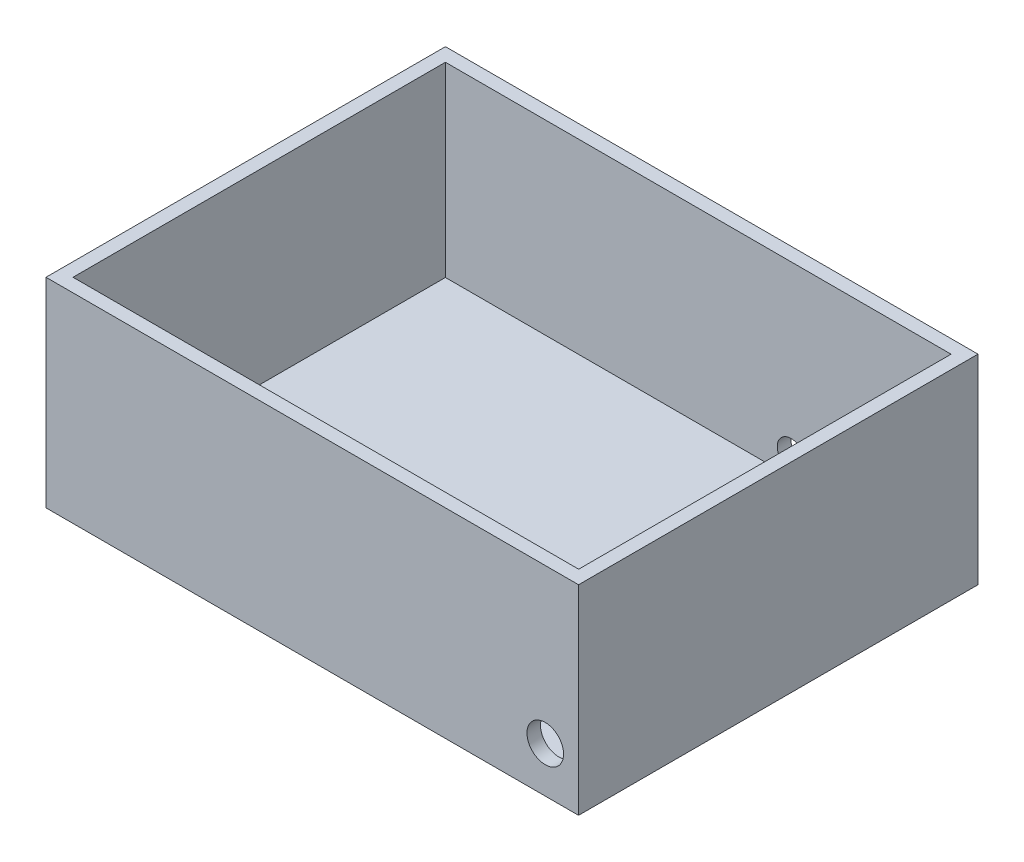
from build123d import *

# Parameters (mm, degrees)
SKETCH4_W                = 203.2
SKETCH4_H                = 152.4
BOSS_EXTRUDE3_DEPTH      = 76.2
SKETCH13_W               = 192.926700431
SKETCH13_H               = 142.08822526
CUT_EXTRUDE9_DEPTH       = 71.12
CUT_EXTRUDE15_DEPTH      = 6.604
CUT_EXTRUDE15_DEPTH_BACK = 12.7
SKETCH20_R               = 6.35
SKETCH18_R               = 5.334
CUT_EXTRUDE17_DEPTH      = 12.7
CUT_EXTRUDE20_DEPTH      = 12.446
CUT_EXTRUDE20_DEPTH_BACK = 10.922
SKETCH23_R               = 6.985
SKETCH24_W               = 0.314102564
SKETCH24_H               = 3.5
CUT_EXTRUDE21_DEPTH      = 3.81


with BuildPart() as part:
    # Sketch4 → Boss-Extrude3 (new body)
    with BuildSketch(Plane(origin=(0, 0, 0), x_dir=(1, 0, 0), z_dir=(0, 1, 0))):
        with Locations((-4.993667346, 11.568489701)):
            Rectangle(SKETCH4_W, SKETCH4_H)
    extrude(amount=BOSS_EXTRUDE3_DEPTH)

    # Sketch13 → Cut-Extrude9 (cut)
    with BuildSketch(Plane(origin=(0, 76.2, 0), x_dir=(1, 0, 0), z_dir=(0, 1, 0))):
        with Locations((-4.977358434, 11.568489701)):
            Rectangle(SKETCH13_W, SKETCH13_H)
    extrude(amount=-CUT_EXTRUDE9_DEPTH, mode=Mode.SUBTRACT)

    # Sketch20 → Cut-Extrude15 (cut, two sides: drawn at the far end of the back side and taken through both)
    with BuildSketch(Plane(origin=(0, 0, 59.475622929), x_dir=(-1, 0, 0), z_dir=(0, 0, -1)).offset(-CUT_EXTRUDE15_DEPTH_BACK)):
        with Locations((-83.898799797, 17.359051545)):
            Circle(SKETCH20_R)
    extrude(amount=CUT_EXTRUDE15_DEPTH + CUT_EXTRUDE15_DEPTH_BACK, mode=Mode.SUBTRACT)

    # Sketch18 → Cut-Extrude17 (cut)
    with BuildSketch(Plane.XY.offset(-82.612602331)):
        with Locations((83.831407255, 12.504982992)):
            Circle(SKETCH18_R)
        with Locations((30.491407255, 12.504982992)):
            Circle(SKETCH18_R)
    extrude(amount=-CUT_EXTRUDE17_DEPTH, mode=Mode.SUBTRACT)

    # Sketch23 → Cut-Extrude20 (cut, two sides: drawn at the far end of the back side and taken through both)
    with BuildSketch(Plane.XY.offset(64.631510299).offset(-CUT_EXTRUDE20_DEPTH_BACK)):
        with Locations((83.898799797, 17.359051545)):
            Circle(SKETCH23_R)
    extrude(amount=CUT_EXTRUDE20_DEPTH + CUT_EXTRUDE20_DEPTH_BACK, mode=Mode.SUBTRACT)

    # Sketch24 → Cut-Extrude21 (cut)
    # profile 1 of 24: a face of its own
    with BuildSketch(Plane.XZ):
        Polygon((-100.776075316, 60.286370222), (-98.891459931, 60.286370222), (-98.891459931, 59.658165094), (-99.519665059, 59.658165094), (-99.519665059, 56.786370222), (-100.147870187, 56.786370222), (-100.147870187, 59.658165094), (-100.776075316, 59.658165094), align=None)
    # profile 2 of 24: a face of its own
    with BuildSketch(Plane.XZ):
        Polygon((-98.397870187, 60.286370222), (-97.769665059, 60.286370222), (-97.769665059, 58.940216376), (-96.558126598, 58.940216376), (-96.558126598, 60.286370222), (-95.92992147, 60.286370222), (-95.92992147, 56.786370222), (-96.558126598, 56.786370222), (-96.558126598, 58.312011247), (-97.769665059, 58.312011247), (-97.769665059, 56.786370222), (-98.397870187, 56.786370222), align=None)
    # profile 3 of 24: a face of its own
    with BuildSketch(Plane.XZ):
        Polygon((-95.122229162, 60.286370222), (-93.237613777, 60.286370222), (-93.237613777, 59.658165094), (-94.494024034, 59.658165094), (-94.494024034, 58.985088171), (-93.237613777, 58.985088171), (-93.237613777, 58.356883042), (-94.494024034, 58.356883042), (-94.494024034, 57.41457535), (-93.237613777, 57.41457535), (-93.237613777, 56.786370222), (-95.122229162, 56.786370222), align=None)
    # profile 4 of 24: a face of its own
    with BuildSketch(Plane.XZ):
        with BuildLine():
            add(Edge.make_bspline(
                [(-89.618423072, 60.376113812), (-89.557571283, 60.37453825), (-89.437436068, 60.371427734), (-89.260760518, 60.345499157), (-89.09050096, 60.303252257), (-88.926734382, 60.244526011), (-88.769870839, 60.167729814), (-88.619357019, 60.075040887), (-88.475732056, 59.964709783), (-88.340467704, 59.839310345), (-88.215459047, 59.702943931), (-88.107138972, 59.556121243), (-88.014767587, 59.402646604), (-87.938209935, 59.242108773), (-87.879897034, 59.07339595), (-87.838976459, 58.897368348), (-87.812687017, 58.714076044), (-87.809663327, 58.589278968), (-87.808126598, 58.525853395)],
                knots=[0, 0, 0, 0, 1.014329547, 2.002516266, 2.970391464, 3.935626869, 4.897733899, 5.877609409, 6.878433252, 7.912639331, 8.949961323, 9.958554974, 10.949718813, 11.932905612, 12.9188844, 13.919928257, 14.942845884, 16, 16, 16, 16], degree=3))
            add(Edge.make_bspline(
                [(-87.808126598, 58.525853395), (-87.809763148, 58.463142481), (-87.812988022, 58.339568614), (-87.837903209, 58.157965421), (-87.879512891, 57.983823441), (-87.93683676, 57.8167485), (-88.012005945, 57.657549851), (-88.102575988, 57.505211034), (-88.21093686, 57.361145788), (-88.333136215, 57.225431425), (-88.467667099, 57.10224152), (-88.610156662, 56.993680629), (-88.759946975, 56.901690226), (-88.916818793, 56.826312449), (-89.08110852, 56.767814532), (-89.252410339, 56.72654), (-89.430713652, 56.701456634), (-89.551968551, 56.698252825), (-89.61351522, 56.696626632)],
                knots=[0, 0, 0, 0, 1.051557043, 2.072126891, 3.067553643, 4.050577992, 5.02905126, 6.015227836, 7.017913613, 8.04756643, 9.074058332, 10.072836633, 11.047628519, 12.017157415, 12.98668631, 13.966869689, 14.968021931, 16, 16, 16, 16], degree=3))
            add(Edge.make_bspline(
                [(-89.61351522, 56.696626632), (-89.677885655, 56.698085407), (-89.804364761, 56.7009517), (-89.9894675, 56.728208839), (-90.166811918, 56.769267613), (-90.33490822, 56.83054563), (-90.495468323, 56.907148303), (-90.647312545, 57.001489088), (-90.790389856, 57.11341208), (-90.923879542, 57.240050888), (-91.04482152, 57.37862152), (-91.151576539, 57.525009104), (-91.241626766, 57.678095369), (-91.314975495, 57.837951961), (-91.372800686, 58.003585411), (-91.413589789, 58.176004474), (-91.437684885, 58.354795627), (-91.441041192, 58.476234152), (-91.442741982, 58.537772465)],
                knots=[0, 0, 0, 0, 1.067978421, 2.098431617, 3.099715153, 4.085208694, 5.062210972, 6.048429807, 7.046490867, 8.072918869, 9.098532598, 10.095778865, 11.076610158, 12.041847152, 13.011192615, 13.984257998, 14.978533688, 16, 16, 16, 16], degree=3))
            add(Edge.make_bspline(
                [(-91.442741982, 58.537772465), (-91.442208176, 58.579172221), (-91.441147324, 58.661447516), (-91.428368235, 58.783375304), (-91.40997002, 58.902923225), (-91.382759935, 59.01961464), (-91.349706635, 59.134272752), (-91.306881416, 59.245830296), (-91.258134728, 59.355479013), (-91.201178812, 59.461923815), (-91.137849341, 59.564185319), (-91.068751249, 59.661781141), (-90.993710791, 59.753531205), (-90.912969697, 59.840038454), (-90.826249722, 59.92073427), (-90.734691577, 59.996761015), (-90.636519568, 60.066099147), (-90.533882372, 60.130442042), (-90.427358634, 60.188626206), (-90.317382002, 60.238150827), (-90.206218212, 60.281399835), (-90.092382266, 60.315533864), (-89.977094118, 60.343335673), (-89.859122149, 60.361721487), (-89.739532167, 60.374500222), (-89.658888576, 60.375574672), (-89.618423072, 60.376113812)],
                knots=[0, 0, 0, 0, 1.034744296, 2.056386356, 3.06226378, 4.057406941, 5.050368692, 6.043467995, 7.042652155, 8.049140477, 9.059438543, 10.048523776, 11.036952808, 12.020949711, 13.004946614, 13.997082645, 14.994316842, 16.007702937, 17.024872941, 18.026463647, 19.021641123, 20.005082605, 20.995858141, 21.984425357, 22.988620895, 24, 24, 24, 24], degree=3))
        make_face()
        with BuildLine():
            add(Edge.make_bspline(
                [(-89.628238777, 59.747908683), (-89.669192023, 59.746809816), (-89.750017344, 59.744641091), (-89.868573369, 59.728118341), (-89.982391339, 59.701729632), (-90.090840318, 59.663505908), (-90.194390332, 59.61485681), (-90.293224943, 59.555952322), (-90.385975496, 59.484767669), (-90.47387873, 59.405124437), (-90.553284838, 59.316383574), (-90.623442639, 59.221282647), (-90.682153418, 59.119980473), (-90.731324063, 59.013418126), (-90.768338661, 58.90039734), (-90.79470305, 58.781803419), (-90.811364359, 58.65743202), (-90.813464538, 58.572648199), (-90.814536854, 58.529359004)],
                knots=[0, 0, 0, 0, 1.033739768, 2.040188636, 3.016340934, 3.979330865, 4.937572243, 5.900995986, 6.878200029, 7.884839167, 8.891893314, 9.879764717, 10.863503415, 11.843163062, 12.837761627, 13.859916423, 14.907309254, 16, 16, 16, 16], degree=3))
            add(Edge.make_bspline(
                [(-90.814536854, 58.529359004), (-90.813115127, 58.481384838), (-90.810328777, 58.38736342), (-90.790723679, 58.25020751), (-90.757181309, 58.120677366), (-90.708746779, 57.9994065), (-90.648675255, 57.88504829), (-90.574075956, 57.779004358), (-90.486157037, 57.680639764), (-90.418425014, 57.623210417), (-90.384048072, 57.59406253)],
                knots=[0, 0, 0, 0, 1.078454662, 2.113592447, 3.107694534, 4.079536787, 5.043276885, 6.005368276, 6.987637804, 8, 8, 8, 8], degree=3))
            add(Edge.make_bspline(
                [(-90.384048072, 57.59406253), (-90.355886794, 57.57252919), (-90.300198715, 57.529947661), (-90.211308417, 57.475370696), (-90.119768914, 57.428592793), (-90.024889424, 57.3907968), (-89.92687033, 57.361067108), (-89.825725071, 57.340247893), (-89.721596963, 57.327182035), (-89.651180656, 57.325620418), (-89.615618585, 57.32483176)],
                knots=[0, 0, 0, 0, 1.023928204, 2.024787132, 3.009472467, 3.9914905, 4.972207045, 5.96565515, 6.972602802, 8, 8, 8, 8], degree=3))
            add(Edge.make_bspline(
                [(-89.615618585, 57.32483176), (-89.575369531, 57.325939945), (-89.496178251, 57.328120333), (-89.37982921, 57.344439679), (-89.268363295, 57.372057904), (-89.161088517, 57.409946315), (-89.058314207, 57.459206245), (-88.960542651, 57.519937766), (-88.867602431, 57.591395171), (-88.779811184, 57.672084293), (-88.699565834, 57.761174734), (-88.629554438, 57.85678292), (-88.56897695, 57.956802315), (-88.520828809, 58.062648544), (-88.482351847, 58.173322466), (-88.456304768, 58.289314234), (-88.439502708, 58.410145685), (-88.437401938, 58.492375757), (-88.436331726, 58.534266856)],
                knots=[0, 0, 0, 0, 1.026359118, 2.019393844, 2.989460624, 3.950973911, 4.916101784, 5.890408035, 6.881132271, 7.902007068, 8.92769091, 9.933912415, 10.920395702, 11.90457117, 12.894218921, 13.903490204, 14.931958862, 16, 16, 16, 16], degree=3))
            add(Edge.make_bspline(
                [(-88.436331726, 58.534266856), (-88.437438967, 58.57591707), (-88.439618402, 58.657899164), (-88.455966471, 58.778419958), (-88.483409549, 58.893899656), (-88.521411735, 59.004526849), (-88.569938514, 59.110409993), (-88.6299468, 59.211176739), (-88.70122603, 59.306729671), (-88.782135717, 59.396417632), (-88.87020094, 59.478835123), (-88.964747755, 59.550358524), (-89.063130638, 59.612510085), (-89.167606971, 59.661197108), (-89.276039256, 59.699985956), (-89.389089154, 59.728550621), (-89.507184846, 59.744525018), (-89.587527787, 59.746770741), (-89.628238777, 59.747908683)],
                knots=[0, 0, 0, 0, 1.055025985, 2.07665775, 3.074803781, 4.057872707, 5.035505728, 6.020516407, 7.023567878, 8.050795229, 9.077271434, 10.074415901, 11.050397877, 12.019801805, 12.988065821, 13.964604439, 14.968634123, 16, 16, 16, 16], degree=3))
        make_face(mode=Mode.SUBTRACT)
    # profile 5 of 24: a face of its own
    with BuildSketch(Plane.XZ):
        Polygon((-87.17992147, 60.286370222), (-86.614116181, 60.286370222), (-85.026075316, 57.983185126), (-85.026075316, 60.286370222), (-84.397870187, 60.286370222), (-84.397870187, 56.786370222), (-84.967882207, 56.786370222), (-86.551716341, 59.0825441), (-86.551716341, 56.786370222), (-87.17992147, 56.786370222), align=None)
    # profile 6 of 24: a face of its own
    with BuildSketch(Plane.XZ):
        Polygon((-83.59017788, 60.286370222), (-82.961972752, 60.286370222), (-82.961972752, 57.41457535), (-81.974793264, 57.41457535), (-81.974793264, 56.786370222), (-83.59017788, 56.786370222), align=None)
    # profile 7 of 24: a face of its own
    with BuildSketch(Plane.XZ):
        Polygon((-81.727998393, 60.286370222), (-81.028979963, 60.286370222), (-80.404280444, 59.058004837), (-79.778178681, 60.286370222), (-79.080562495, 60.286370222), (-80.09017788, 58.302195542), (-80.09017788, 56.786370222), (-80.718383008, 56.786370222), (-80.718383008, 58.302195542), align=None)
    # profile 8 of 24: a face of its own
    with BuildSketch(Plane.XZ):
        Polygon((-77.420306085, 60.286370222), (-76.771768425, 60.286370222), (-76.253639418, 58.051895062), (-75.659789258, 60.286370222), (-75.050514418, 60.286370222), (-74.458767623, 58.051895062), (-73.943443104, 60.286370222), (-73.292100957, 60.286370222), (-74.101195508, 56.786370222), (-74.757445508, 56.786370222), (-75.356203521, 59.048890254), (-75.957766021, 56.786370222), (-76.609108168, 56.786370222), align=None)
    # profile 9 of 24: a face of its own
    with BuildSketch(Plane.XZ):
        with BuildLine():
            Line((-69.523571309, 59.729679517), (-69.998931886, 59.274651472))
            add(Edge.make_bspline(
                [(-69.998931886, 59.274651472), (-70.036567013, 59.312331692), (-70.110413344, 59.386266504), (-70.231179781, 59.482497743), (-70.356257158, 59.56431332), (-70.486057155, 59.631587811), (-70.620760584, 59.683771755), (-70.760101618, 59.721100599), (-70.904306947, 59.74324097), (-71.001927517, 59.746340546), (-71.0513157, 59.747908683)],
                knots=[0, 0, 0, 0, 1.075575784, 2.110457258, 3.113929901, 4.09197124, 5.059417775, 6.02750972, 7.002078037, 8, 8, 8, 8], degree=3))
            add(Edge.make_bspline(
                [(-71.0513157, 59.747908683), (-71.094133745, 59.746809897), (-71.17821073, 59.744652333), (-71.301753761, 59.72826794), (-71.419806695, 59.700898549), (-71.532927263, 59.662982828), (-71.640424824, 59.613642491), (-71.742922239, 59.553639048), (-71.839788739, 59.482513469), (-71.930261569, 59.401614046), (-72.012637372, 59.313288211), (-72.084555797, 59.218748334), (-72.145814845, 59.11975656), (-72.196243535, 59.01580643), (-72.234614285, 58.90705749), (-72.262005979, 58.793588684), (-72.279392893, 58.675729768), (-72.281445768, 58.595325196), (-72.282485572, 58.554599389)],
                knots=[0, 0, 0, 0, 1.075001177, 2.110859044, 3.123021556, 4.114053297, 5.101481495, 6.087880186, 7.091499647, 8.114004866, 9.131394192, 10.11971144, 11.092043119, 12.050101265, 13.015322563, 13.981809771, 14.977764287, 16, 16, 16, 16], degree=3))
            add(Edge.make_bspline(
                [(-72.282485572, 58.554599389), (-72.281515693, 58.512464007), (-72.279604897, 58.429451536), (-72.261249548, 58.307627167), (-72.232969973, 58.190423346), (-72.191576215, 58.078709697), (-72.140633035, 57.970955899), (-72.076028689, 57.869249246), (-72.000693557, 57.772036567), (-71.914762252, 57.681010389), (-71.821291183, 57.59710616), (-71.720058974, 57.524728212), (-71.61414573, 57.462281666), (-71.501842006, 57.41282602), (-71.385097062, 57.373118555), (-71.262726769, 57.345121384), (-71.135006676, 57.327945217), (-71.047864408, 57.32587991), (-71.003639418, 57.32483176)],
                knots=[0, 0, 0, 0, 1.022067601, 2.013613092, 2.983553406, 3.943623673, 4.90013463, 5.87121881, 6.861774014, 7.881098904, 8.905697761, 9.905387765, 10.89678721, 11.884561068, 12.87834324, 13.885584958, 14.926927371, 16, 16, 16, 16], degree=3))
            add(Edge.make_bspline(
                [(-71.003639418, 57.32483176), (-70.9748727, 57.325091317), (-70.918397232, 57.325600886), (-70.835557345, 57.333872614), (-70.75621663, 57.34569801), (-70.680067823, 57.361353431), (-70.607879823, 57.38350866), (-70.538653137, 57.409416473), (-70.472793372, 57.439992858), (-70.410657614, 57.476292757), (-70.351321102, 57.516980507), (-70.295339237, 57.563535945), (-70.241730032, 57.614909418), (-70.191119903, 57.671728525), (-70.144365442, 57.734501296), (-70.099968754, 57.802074198), (-70.058438173, 57.87511785), (-70.033898848, 57.926697577), (-70.021367784, 57.953036889)],
                knots=[0, 0, 0, 0, 1.109579412, 2.178351274, 3.208885622, 4.204702371, 5.174744997, 6.119429583, 7.05542196, 7.97267548, 8.893247984, 9.828544973, 10.778894627, 11.756245826, 12.760884819, 13.796418446, 14.874735809, 16, 16, 16, 16], degree=3))
            Line((-70.021367784, 57.953036889), (-71.026075316, 57.953036889))
            Line((-71.026075316, 57.953036889), (-71.026075316, 58.581242017))
            Line((-71.026075316, 58.581242017), (-69.280983168, 58.581242017))
            Line((-69.280983168, 58.581242017), (-69.276075316, 58.431903074))
            add(Edge.make_bspline(
                [(-69.276075316, 58.431903074), (-69.276705938, 58.393549045), (-69.277966058, 58.316909432), (-69.28948223, 58.202806104), (-69.308558594, 58.090216121), (-69.334637809, 57.979252564), (-69.367321662, 57.869371117), (-69.409003807, 57.761623988), (-69.457813343, 57.65528047), (-69.512500966, 57.550792441), (-69.573954119, 57.450533337), (-69.640117462, 57.3556012), (-69.71004779, 57.266160337), (-69.785266061, 57.183456885), (-69.864601001, 57.106796097), (-69.948208782, 57.036472896), (-70.036385121, 56.972427781), (-70.128662913, 56.914119717), (-70.225567768, 56.863016138), (-70.326566903, 56.818562805), (-70.431507825, 56.780809527), (-70.540661464, 56.749860053), (-70.653813036, 56.725980071), (-70.770964962, 56.709605536), (-70.892181586, 56.698478855), (-70.974400257, 56.697251504), (-71.016259611, 56.696626632)],
                knots=[0, 0, 0, 0, 1.006889344, 2.011981806, 3.007738725, 4.003571281, 5.003404394, 6.015442001, 7.03424805, 8.074616296, 9.110249922, 10.119753985, 11.111721717, 12.089233633, 13.052717867, 14.006597561, 14.955430184, 15.912305663, 16.870361111, 17.829300583, 18.807640451, 19.796414044, 20.806216501, 21.841577364, 22.90109906, 24, 24, 24, 24], degree=3))
            add(Edge.make_bspline(
                [(-71.016259611, 56.696626632), (-71.060920702, 56.697243705), (-71.149452307, 56.698466926), (-71.28035815, 56.70992323), (-71.407466333, 56.72883112), (-71.53080856, 56.754998994), (-71.650671206, 56.787567002), (-71.76684833, 56.828447558), (-71.879102316, 56.877076271), (-71.987769315, 56.932165435), (-72.091460442, 56.994641345), (-72.18994331, 57.06340848), (-72.28268038, 57.138909186), (-72.370621567, 57.219879566), (-72.451712226, 57.308309879), (-72.528974288, 57.401333669), (-72.59866467, 57.502362679), (-72.663779853, 57.608121518), (-72.721628702, 57.718565867), (-72.772218352, 57.831653002), (-72.815361177, 57.946728147), (-72.849380337, 58.064327131), (-72.877000709, 58.183629955), (-72.896763603, 58.305155439), (-72.907924633, 58.428888372), (-72.909764585, 58.512043312), (-72.9106907, 58.553898267)],
                knots=[0, 0, 0, 0, 1.084149091, 2.14910686, 3.187506334, 4.202448172, 5.208724393, 6.201130722, 7.189831603, 8.176984443, 9.156919086, 10.126598231, 11.090766514, 12.05840148, 13.026036446, 14.001772938, 14.991905635, 16.003017641, 17.015720547, 18.016462227, 19.009322657, 19.99686681, 20.986544154, 21.980959929, 22.983742515, 24, 24, 24, 24], degree=3))
            add(Edge.make_bspline(
                [(-72.9106907, 58.553898267), (-72.909450434, 58.610997369), (-72.907001275, 58.723751167), (-72.88431835, 58.889838227), (-72.848959049, 59.050510885), (-72.798214892, 59.205183983), (-72.733098156, 59.354070585), (-72.654531279, 59.497520208), (-72.560807616, 59.635380379), (-72.488259064, 59.720734972), (-72.451455925, 59.764034485)],
                knots=[0, 0, 0, 0, 1.034044851, 2.041932006, 3.031217818, 4.011390712, 4.986069675, 5.97149666, 6.970960976, 8, 8, 8, 8], degree=3))
            add(Edge.make_bspline(
                [(-72.451455925, 59.764034485), (-72.428605215, 59.789084565), (-72.3832469, 59.838808599), (-72.310741716, 59.907901155), (-72.23639778, 59.972850714), (-72.159185417, 60.032280061), (-72.079510519, 60.087490133), (-71.997143765, 60.137445973), (-71.912517234, 60.183738202), (-71.824970942, 60.224002963), (-71.734963204, 60.26010368), (-71.642095391, 60.290649962), (-71.547063064, 60.317706708), (-71.449024708, 60.338289952), (-71.348970745, 60.355430107), (-71.246190957, 60.366918337), (-71.140965427, 60.375338391), (-71.069796171, 60.375853294), (-71.033787655, 60.376113812)],
                knots=[0, 0, 0, 0, 1.020590567, 2.025856924, 3.013483481, 3.991664875, 4.957826714, 5.930500614, 6.890802512, 7.860442893, 8.829981142, 9.809047939, 10.802672283, 11.803273349, 12.823572789, 13.857849586, 14.916166035, 16, 16, 16, 16], degree=3))
            add(Edge.make_bspline(
                [(-71.033787655, 60.376113812), (-70.996147066, 60.375533329), (-70.921256113, 60.374378382), (-70.809905669, 60.3663869), (-70.700102514, 60.354057928), (-70.592309369, 60.335563765), (-70.486164481, 60.312756613), (-70.382217279, 60.283535006), (-70.279789639, 60.250333998), (-70.213109632, 60.223863701), (-70.179821309, 60.210649068)],
                knots=[0, 0, 0, 0, 1.03180557, 2.052914215, 3.058998889, 4.059601663, 5.049854447, 6.033765722, 7.018406786, 8, 8, 8, 8], degree=3))
            add(Edge.make_bspline(
                [(-70.179821309, 60.210649068), (-70.151813303, 60.198436369), (-70.094845794, 60.173596076), (-70.011965089, 60.128149596), (-69.928881884, 60.077766957), (-69.846492689, 60.020606052), (-69.764923041, 59.9567738), (-69.683321267, 59.887278419), (-69.602520388, 59.811309554), (-69.550228484, 59.757241918), (-69.523571309, 59.729679517)],
                knots=[0, 0, 0, 0, 0.894392155, 1.819168899, 2.76525314, 3.739198753, 4.75366411, 5.797420238, 6.877176959, 8, 8, 8, 8], degree=3))
        make_face()
    # profile 10 of 24: a face of its own
    with BuildSketch(Plane.XZ):
        Polygon((-69.006844546, 60.286370222), (-67.122229162, 60.286370222), (-67.122229162, 59.658165094), (-67.75043429, 59.658165094), (-67.75043429, 56.786370222), (-68.378639418, 56.786370222), (-68.378639418, 59.658165094), (-69.006844546, 59.658165094), align=None)
    # profile 11 of 24: a face of its own
    with BuildSketch(Plane.XZ):
        Polygon((-100.776075316, 53.228677914), (-100.776075316, 53.587652273), (-98.936331726, 53.587652273), (-98.936331726, 53.228677914), (-99.699152239, 53.228677914), (-99.699152239, 50.087652273), (-100.013254803, 50.087652273), (-100.013254803, 53.228677914), align=None)
    # profile 12 of 24: a face of its own
    with BuildSketch(Plane.XZ):
        Polygon((-98.397870187, 53.587652273), (-96.423511213, 53.587652273), (-96.423511213, 53.228677914), (-98.083767623, 53.228677914), (-98.083767623, 52.151754837), (-96.423511213, 52.151754837), (-96.423511213, 51.792780478), (-98.083767623, 51.792780478), (-98.083767623, 50.446626632), (-96.423511213, 50.446626632), (-96.423511213, 50.087652273), (-98.397870187, 50.087652273), align=None)
    # profile 13 of 24: a face of its own
    with BuildSketch(Plane.XZ):
        Polygon((-94.359408649, 53.587652273), (-92.744024034, 50.087652273), (-93.085470348, 50.087652273), (-93.602898232, 51.209447145), (-95.189536854, 51.209447145), (-95.720987175, 50.087652273), (-96.064536854, 50.087652273), (-94.404280444, 53.587652273), align=None)
        Polygon((-94.385350155, 52.904759645), (-95.018463136, 51.568421504), (-93.768362976, 51.568421504), align=None, mode=Mode.SUBTRACT)
    # profile 14 of 24: a face of its own
    with BuildSketch(Plane.XZ):
        Polygon((-92.295306085, 50.087652273), (-91.833266822, 53.587652273), (-91.788395027, 53.587652273), (-90.343383008, 50.715857401), (-88.90257772, 53.587652273), (-88.857705925, 53.587652273), (-88.391459931, 50.087652273), (-88.705562495, 50.087652273), (-89.042100957, 52.603978395), (-90.304821309, 50.087652273), (-90.376335732, 50.087652273), (-91.644665059, 52.611690735), (-91.979100155, 50.087652273), align=None)
    # profile 15 of 24: a face of its own
    with BuildSketch(Plane.XZ):
        with BuildLine():
            Line((-86.192741982, 52.510729196), (-86.506844546, 52.510729196))
            add(Edge.make_bspline(
                [(-86.506844546, 52.510729196), (-86.504797393, 52.552400084), (-86.500776839, 52.634240599), (-86.48194855, 52.753564505), (-86.455007673, 52.867619304), (-86.416916219, 52.975489218), (-86.369609941, 53.078128025), (-86.312879914, 53.175128041), (-86.245686063, 53.266119229), (-86.169479329, 53.350258073), (-86.08671069, 53.427445643), (-85.997404751, 53.494100886), (-85.903559723, 53.550418558), (-85.805460324, 53.597499799), (-85.701999761, 53.632839645), (-85.594116903, 53.659061285), (-85.481337767, 53.674837631), (-85.404497745, 53.676533416), (-85.365418264, 53.677395863)],
                knots=[0, 0, 0, 0, 1.10065271, 2.161652631, 3.183658789, 4.190468796, 5.17591951, 6.163126047, 7.15150782, 8.156236427, 9.156009102, 10.134482811, 11.092018607, 12.041330605, 13.001268258, 13.972401359, 14.968799086, 16, 16, 16, 16], degree=3))
            add(Edge.make_bspline(
                [(-85.365418264, 53.677395863), (-85.32704019, 53.676497406), (-85.251628646, 53.674731972), (-85.141566631, 53.659570942), (-85.036789337, 53.635825351), (-84.93750157, 53.602509934), (-84.844495506, 53.557725507), (-84.757072461, 53.503927968), (-84.67419165, 53.441708137), (-84.599584867, 53.368454324), (-84.531076787, 53.290251939), (-84.471974532, 53.206764035), (-84.421361369, 53.12053475), (-84.379173689, 53.030906548), (-84.34811755, 52.93703552), (-84.324539342, 52.840288317), (-84.311211928, 52.739663506), (-84.309166505, 52.67155695), (-84.308126598, 52.636931119)],
                knots=[0, 0, 0, 0, 1.111607364, 2.184268762, 3.212621178, 4.221274766, 5.211760367, 6.196651075, 7.1921475, 8.207485113, 9.220403448, 10.201281604, 11.166441695, 12.114753415, 13.065576456, 14.026450734, 14.996634279, 16, 16, 16, 16], degree=3))
            add(Edge.make_bspline(
                [(-84.308126598, 52.636931119), (-84.309813243, 52.58818131), (-84.313156934, 52.491537182), (-84.342012637, 52.349332824), (-84.386594734, 52.211427765), (-84.440667763, 52.100448713), (-84.495288331, 52.01147182), (-84.543468127, 51.937556178), (-84.601120479, 51.858729762), (-84.667717892, 51.774198653), (-84.742255699, 51.683704283), (-84.825270367, 51.587209517), (-84.917396057, 51.485739212), (-84.982054239, 51.416433399), (-85.015558489, 51.380520863)],
                knots=[0, 0, 0, 0, 1.184203166, 2.347625244, 3.513805382, 4.700623107, 5.337941753, 6.051866363, 6.845199593, 7.711357327, 8.668078039, 9.695487809, 10.805859518, 12, 12, 12, 12], degree=3))
            Line((-85.015558489, 51.380520863), (-85.891259611, 50.446626632))
            Line((-85.891259611, 50.446626632), (-84.263254803, 50.446626632))
            Line((-84.263254803, 50.446626632), (-84.263254803, 50.087652273))
            Line((-84.263254803, 50.087652273), (-86.641459931, 50.087652273))
            Line((-86.641459931, 50.087652273), (-85.284088136, 51.536169901))
            add(Edge.make_bspline(
                [(-85.284088136, 51.536169901), (-85.251040249, 51.570668208), (-85.187562022, 51.636932394), (-85.097779445, 51.733675355), (-85.017140457, 51.823424895), (-84.945123064, 51.906011444), (-84.883289559, 51.982643012), (-84.828417327, 52.050837715), (-84.784451736, 52.113592166), (-84.73673634, 52.186332779), (-84.690522359, 52.275145097), (-84.650810003, 52.383678786), (-84.626595155, 52.495406039), (-84.623690319, 52.570908076), (-84.622229162, 52.608886247)],
                knots=[0, 0, 0, 0, 1.329631726, 2.553950428, 3.673215718, 4.687767853, 5.603093632, 6.413772471, 7.123043292, 7.734684054, 8.834405432, 9.900288307, 10.943827018, 12, 12, 12, 12], degree=3))
            add(Edge.make_bspline(
                [(-84.622229162, 52.608886247), (-84.622864904, 52.632767646), (-84.62411783, 52.679833296), (-84.635175528, 52.748839055), (-84.651886034, 52.815403869), (-84.675831292, 52.879732488), (-84.707438032, 52.94117814), (-84.745911412, 52.99981562), (-84.790301475, 53.056504586), (-84.841652745, 53.109657884), (-84.898064264, 53.158339089), (-84.957658514, 53.201463175), (-85.020708618, 53.237502285), (-85.08694874, 53.267045783), (-85.15619421, 53.290221164), (-85.228578955, 53.306279743), (-85.303902971, 53.316362227), (-85.355336467, 53.317726399), (-85.381544066, 53.318421504)],
                knots=[0, 0, 0, 0, 0.991446411, 1.95395049, 2.89581595, 3.838931463, 4.798493298, 5.75982156, 6.748411868, 7.785213223, 8.824556874, 9.840280684, 10.836137867, 11.835679398, 12.848801643, 13.863922112, 14.911575587, 16, 16, 16, 16], degree=3))
            add(Edge.make_bspline(
                [(-85.381544066, 53.318421504), (-85.408914898, 53.317706472), (-85.462666695, 53.316302266), (-85.541585728, 53.306479602), (-85.616871505, 53.289533762), (-85.688713408, 53.266357088), (-85.757232994, 53.236898539), (-85.822097038, 53.200206794), (-85.883159927, 53.156423301), (-85.940536451, 53.106782745), (-85.99340043, 53.051515143), (-86.039847305, 52.98990518), (-86.08043132, 52.923077765), (-86.115840553, 52.851213214), (-86.144596243, 52.773659434), (-86.166569394, 52.69069173), (-86.18395624, 52.602670348), (-86.189764761, 52.541885263), (-86.192741982, 52.510729196)],
                knots=[0, 0, 0, 0, 1.031018746, 2.02475058, 2.990194455, 3.934040569, 4.864654155, 5.795059489, 6.735614925, 7.690564532, 8.649604399, 9.611025574, 10.590972636, 11.591080095, 12.624614302, 13.701020113, 14.821632451, 16, 16, 16, 16], degree=3))
        make_face()
    # profile 16 of 24: a face of its own
    with BuildSketch(Plane.XZ):
        with BuildLine():
            Line((-81.75043429, 53.587652273), (-81.75043429, 53.228677914))
            Line((-81.75043429, 53.228677914), (-82.940237976, 53.228677914))
            Line((-82.940237976, 53.228677914), (-83.129540861, 52.308104997))
            add(Edge.make_bspline(
                [(-83.129540861, 52.308104997), (-83.092484986, 52.318335269), (-83.02069509, 52.338154803), (-82.914735229, 52.360160573), (-82.814143026, 52.373426017), (-82.748867656, 52.375237328), (-82.717281245, 52.376113812)],
                knots=[0, 0, 0, 0, 1.100273476, 2.13160584, 3.095893838, 4, 4, 4, 4], degree=3))
            add(Edge.make_bspline(
                [(-82.717281245, 52.376113812), (-82.678197505, 52.375267876), (-82.601349108, 52.373604555), (-82.488910161, 52.357632706), (-82.381577268, 52.332492791), (-82.279574898, 52.297372269), (-82.182714347, 52.252462536), (-82.091886786, 52.196362596), (-82.005728873, 52.130829264), (-81.925786279, 52.055484252), (-81.853261971, 51.972562636), (-81.789495981, 51.883404765), (-81.735333391, 51.788877103), (-81.691772636, 51.688076494), (-81.656988301, 51.58211734), (-81.633836307, 51.469884758), (-81.618419598, 51.352436638), (-81.616697211, 51.272132068), (-81.615818905, 51.231181921)],
                knots=[0, 0, 0, 0, 1.052922333, 2.070308379, 3.05430497, 4.020497103, 4.973039431, 5.925935799, 6.892292201, 7.88610001, 8.88166317, 9.857072816, 10.836096531, 11.812156883, 12.81219415, 13.836441305, 14.89672472, 16, 16, 16, 16], degree=3))
            add(Edge.make_bspline(
                [(-81.615818905, 51.231181921), (-81.616483981, 51.2026597), (-81.617805143, 51.146000713), (-81.624523731, 51.061856512), (-81.637459447, 50.979493679), (-81.654827171, 50.898901287), (-81.677369589, 50.820231915), (-81.704658643, 50.743260387), (-81.738054671, 50.66846578), (-81.774686046, 50.595140385), (-81.815932524, 50.524941878), (-81.861711031, 50.459292891), (-81.910076522, 50.39720861), (-81.962117908, 50.339354877), (-82.018318903, 50.286111859), (-82.07799887, 50.237163578), (-82.140681589, 50.191682247), (-82.207336831, 50.151514052), (-82.276479314, 50.114551096), (-82.349107531, 50.084227559), (-82.423568232, 50.05711703), (-82.500933107, 50.035507503), (-82.58102692, 50.018574948), (-82.663981695, 50.007074348), (-82.749362365, 49.99869791), (-82.807237378, 49.998173553), (-82.83647195, 49.997908683)],
                knots=[0, 0, 0, 0, 1.056347294, 2.098418968, 3.122841568, 4.141288669, 5.149314143, 6.15115421, 7.162517403, 8.180376062, 9.185164535, 10.17417709, 11.141909838, 12.097768115, 13.052685741, 14.0056014, 14.954263652, 15.917497458, 16.885230207, 17.854509472, 18.828990115, 19.81800267, 20.826176721, 21.857883937, 22.917946725, 24, 24, 24, 24], degree=3))
            add(Edge.make_bspline(
                [(-82.83647195, 49.997908683), (-82.871346131, 49.998599521), (-82.939956962, 49.999958663), (-83.040477529, 50.014177149), (-83.137192134, 50.034541065), (-83.229322236, 50.065177335), (-83.317693499, 50.10356463), (-83.401116217, 50.152080801), (-83.481721993, 50.207059905), (-83.55623403, 50.271940258), (-83.625390143, 50.34285594), (-83.687296652, 50.419813581), (-83.742430229, 50.501543023), (-83.789907976, 50.588441177), (-83.830405997, 50.680279708), (-83.862220986, 50.777402709), (-83.887899341, 50.879302713), (-83.898762761, 50.949456223), (-83.904280444, 50.985088171)],
                knots=[0, 0, 0, 0, 1.0467383, 2.05933395, 3.04377827, 4.011590433, 4.970194871, 5.932262533, 6.905835911, 7.896367577, 8.894135286, 9.877477877, 10.858688626, 11.851381753, 12.8477658, 13.868841284, 14.917554742, 16, 16, 16, 16], degree=3))
            Line((-83.904280444, 50.985088171), (-83.59017788, 50.985088171))
            add(Edge.make_bspline(
                [(-83.59017788, 50.985088171), (-83.582449322, 50.951711718), (-83.567594606, 50.887560323), (-83.534988857, 50.797428982), (-83.495122982, 50.717109758), (-83.447718633, 50.645540175), (-83.391168603, 50.583131178), (-83.326639174, 50.527514116), (-83.254291451, 50.477338986), (-83.173898221, 50.435516219), (-83.089085142, 50.399847466), (-83.000317932, 50.376095771), (-82.910013585, 50.359394878), (-82.848935215, 50.357723117), (-82.818242784, 50.356883042)],
                knots=[0, 0, 0, 0, 1.136247022, 2.183929868, 3.172523383, 4.106158343, 5.02341133, 5.958108904, 6.928429099, 7.938127109, 8.96079061, 9.975095812, 10.982467395, 12, 12, 12, 12], degree=3))
            add(Edge.make_bspline(
                [(-82.818242784, 50.356883042), (-82.788284339, 50.35770382), (-82.729295917, 50.359319939), (-82.64248453, 50.371758951), (-82.558671656, 50.390916522), (-82.478684299, 50.419586377), (-82.40112276, 50.454431095), (-82.327948989, 50.499146171), (-82.257046112, 50.55060619), (-82.190617979, 50.60956282), (-82.129778529, 50.674532514), (-82.076022408, 50.744009908), (-82.031245495, 50.818126754), (-81.993511386, 50.895599907), (-81.964858087, 50.977278464), (-81.944417106, 51.06277964), (-81.932414047, 51.15231462), (-81.930762867, 51.21338393), (-81.92992147, 51.244503235)],
                knots=[0, 0, 0, 0, 1.027316725, 2.022795036, 3.002884548, 3.971462791, 4.93288096, 5.914575861, 6.907176829, 7.935150275, 8.956128384, 9.956726525, 10.942570165, 11.921478529, 12.907843606, 13.90538589, 14.932640048, 16, 16, 16, 16], degree=3))
            add(Edge.make_bspline(
                [(-81.92992147, 51.244503235), (-81.930579949, 51.272578986), (-81.931868829, 51.327533275), (-81.942399399, 51.407932482), (-81.960716372, 51.484005524), (-81.986140251, 51.556119758), (-82.018419759, 51.6243432), (-82.057866072, 51.688746261), (-82.105219469, 51.748480094), (-82.159311358, 51.803572647), (-82.218569399, 51.854417522), (-82.284013142, 51.897761609), (-82.354273068, 51.934225526), (-82.428502668, 51.965693525), (-82.508467566, 51.98829427), (-82.592584199, 52.005262156), (-82.681760907, 52.015077518), (-82.742731595, 52.016439407), (-82.774072111, 52.017139453)],
                knots=[0, 0, 0, 0, 1.045622112, 2.046656509, 3.013763289, 3.955457236, 4.890082067, 5.820317437, 6.762574623, 7.722996705, 8.69280354, 9.665887285, 10.63943826, 11.638615906, 12.663482002, 13.728887084, 14.832589034, 16, 16, 16, 16], degree=3))
            add(Edge.make_bspline(
                [(-82.774072111, 52.017139453), (-82.801201039, 52.016558861), (-82.857215395, 52.015360088), (-82.943138221, 52.006533591), (-83.033429944, 51.992294297), (-83.12774444, 51.972708049), (-83.226364948, 51.947076973), (-83.329083349, 51.916362472), (-83.436115615, 51.879640473), (-83.50823334, 51.851908259), (-83.545306085, 51.837652273)],
                knots=[0, 0, 0, 0, 0.817624296, 1.688186739, 2.600797293, 3.572016777, 4.590301741, 5.671205678, 6.80286297, 8, 8, 8, 8], degree=3))
            Line((-83.545306085, 51.837652273), (-83.186331726, 53.587652273))
            Line((-83.186331726, 53.587652273), (-81.75043429, 53.587652273))
        make_face()
    # profile 17 of 24: a face of its own
    with BuildSketch(Plane.XZ):
        Polygon((-100.641459931, 46.75431894), (-100.30492147, 46.75431894), (-99.138955925, 43.998209164), (-97.972289258, 46.75431894), (-97.635049675, 46.75431894), (-99.115818905, 43.25431894), (-99.1606907, 43.25431894), align=None)
    # profile 18 of 24: a face of its own
    with BuildSketch(Plane.XZ):
        Polygon((-97.006844546, 46.75431894), (-95.032485572, 46.75431894), (-95.032485572, 46.395344581), (-96.692741982, 46.395344581), (-96.692741982, 45.318421504), (-95.032485572, 45.318421504), (-95.032485572, 44.959447145), (-96.692741982, 44.959447145), (-96.692741982, 43.613293299), (-95.032485572, 43.613293299), (-95.032485572, 43.25431894), (-97.006844546, 43.25431894), align=None)
    # profile 19 of 24: a face of its own
    with BuildSketch(Plane.XZ):
        with BuildLine():
            Line((-94.404280444, 46.75431894), (-93.703859771, 46.75431894))
            add(Edge.make_bspline(
                [(-93.703859771, 46.75431894), (-93.657118642, 46.754163354), (-93.567370498, 46.753864611), (-93.438797228, 46.752198849), (-93.321970131, 46.747424493), (-93.216950291, 46.743315909), (-93.123739636, 46.735823968), (-93.042052345, 46.728663321), (-92.972264648, 46.71928966), (-92.930018797, 46.710584237), (-92.910891021, 46.706642658)],
                knots=[0, 0, 0, 0, 1.410062039, 2.707475311, 3.878576406, 4.937260626, 5.877586885, 6.699081471, 7.410979367, 8, 8, 8, 8], degree=3))
            add(Edge.make_bspline(
                [(-92.910891021, 46.706642658), (-92.885284397, 46.700315892), (-92.834617407, 46.687797329), (-92.761667341, 46.661337728), (-92.692153017, 46.630718103), (-92.626363193, 46.594754383), (-92.564627402, 46.553179603), (-92.506309091, 46.506711481), (-92.451143628, 46.455604275), (-92.401361997, 46.398569434), (-92.354422946, 46.338732924), (-92.314834319, 46.274029167), (-92.280707839, 46.20636764), (-92.253537322, 46.135060222), (-92.231659349, 46.06079845), (-92.21623311, 45.982909653), (-92.206981922, 45.901748678), (-92.206040066, 45.846390769), (-92.205562495, 45.818321344)],
                knots=[0, 0, 0, 0, 1.027469482, 2.033020251, 3.019912614, 3.986113645, 4.951240523, 5.91722682, 6.890402269, 7.87763091, 8.8651537, 9.85103654, 10.82876324, 11.815024772, 12.821070561, 13.842952187, 14.906261191, 16, 16, 16, 16], degree=3))
            add(Edge.make_bspline(
                [(-92.205562495, 45.818321344), (-92.207031493, 45.771686239), (-92.209897889, 45.680689071), (-92.236622993, 45.54862819), (-92.280399512, 45.425438875), (-92.340722801, 45.311276237), (-92.417542277, 45.208365592), (-92.509867068, 45.117975137), (-92.61774868, 45.042335224), (-92.718177996, 44.989882419), (-92.806892195, 44.956289511), (-92.879925508, 44.932653152), (-92.959592486, 44.914391186), (-93.04512982, 44.898031055), (-93.136893476, 44.88567936), (-93.234663515, 44.876632766), (-93.338509667, 44.870978717), (-93.409848736, 44.870136712), (-93.446548072, 44.869703555)],
                knots=[0, 0, 0, 0, 1.260483769, 2.459530307, 3.627416485, 4.787058657, 5.939039949, 7.08810263, 8.267026773, 9.491475466, 10.141966685, 10.831826277, 11.566392101, 12.351337768, 13.187381173, 14.07005841, 15.007169909, 16, 16, 16, 16], degree=3))
            Line((-93.446548072, 44.869703555), (-92.1606907, 43.25431894))
            Line((-92.1606907, 43.25431894), (-92.549112175, 43.25431894))
            Line((-92.549112175, 43.25431894), (-93.834969546, 44.869703555))
            Line((-93.834969546, 44.869703555), (-94.09017788, 44.869703555))
            Line((-94.09017788, 44.869703555), (-94.09017788, 43.25431894))
            Line((-94.09017788, 43.25431894), (-94.404280444, 43.25431894))
            Line((-94.404280444, 43.25431894), (-94.404280444, 46.75431894))
        make_face()
        with BuildLine():
            Line((-94.09017788, 46.395344581), (-94.09017788, 45.228677914))
            Line((-94.09017788, 45.228677914), (-93.449352559, 45.223770062))
            add(Edge.make_bspline(
                [(-93.449352559, 45.223770062), (-93.41943252, 45.223756825), (-93.361438963, 45.223731169), (-93.277538298, 45.227724945), (-93.199418187, 45.232268263), (-93.127377435, 45.239217609), (-93.061383859, 45.24817368), (-93.001470446, 45.259376665), (-92.947539394, 45.272428727), (-92.884640856, 45.292630353), (-92.814404324, 45.324636371), (-92.738072864, 45.37120187), (-92.673070527, 45.429770989), (-92.618152664, 45.496744445), (-92.574023233, 45.570380694), (-92.542911179, 45.649797063), (-92.523168736, 45.732988661), (-92.520840191, 45.790166769), (-92.519665059, 45.819022465)],
                knots=[0, 0, 0, 0, 1.146690395, 2.22261258, 3.21895312, 4.145990853, 4.996080663, 5.770904154, 6.481378293, 7.121626537, 8.300444488, 9.431385265, 10.535395872, 11.636531494, 12.74115979, 13.810798291, 14.895190096, 16, 16, 16, 16], degree=3))
            add(Edge.make_bspline(
                [(-92.519665059, 45.819022465), (-92.52086718, 45.847169039), (-92.523249346, 45.902945278), (-92.542698114, 45.984601188), (-92.575587496, 46.061668138), (-92.619909734, 46.133832623), (-92.673908888, 46.199338359), (-92.737226701, 46.255385512), (-92.808131896, 46.301634977), (-92.874403095, 46.331189357), (-92.933637307, 46.349309211), (-92.985066967, 46.362060374), (-93.043178445, 46.372304843), (-93.108253904, 46.380512904), (-93.180015534, 46.387567848), (-93.258826185, 46.392319627), (-93.344162966, 46.395133491), (-93.403309897, 46.39527258), (-93.43392788, 46.395344581)],
                knots=[0, 0, 0, 0, 1.101028733, 2.181837193, 3.264309656, 4.369019818, 5.486613113, 6.575447106, 7.666700264, 8.788928104, 9.402425223, 10.0903467, 10.862060571, 11.710948788, 12.657782767, 13.684531032, 14.801375019, 16, 16, 16, 16], degree=3))
            Line((-93.43392788, 46.395344581), (-94.09017788, 46.395344581))
        make_face(mode=Mode.SUBTRACT)
    # profile 20 of 24: a face of its own
    with BuildSketch(Plane.XZ):
        with BuildLine():
            Line((-91.801716341, 43.929499228), (-91.505842944, 44.106883042))
            add(Edge.make_bspline(
                [(-91.505842944, 44.106883042), (-91.478324707, 44.060818657), (-91.425600826, 43.972561074), (-91.337649467, 43.853303033), (-91.246516556, 43.751940876), (-91.151527222, 43.669064269), (-91.053261274, 43.603815382), (-90.95107722, 43.55761315), (-90.84531941, 43.528797175), (-90.773345588, 43.525297088), (-90.737413457, 43.523549709)],
                knots=[0, 0, 0, 0, 1.272034388, 2.437168799, 3.508375237, 4.49857839, 5.41946034, 6.295179144, 7.148887113, 8, 8, 8, 8], degree=3))
            add(Edge.make_bspline(
                [(-90.737413457, 43.523549709), (-90.706726596, 43.524404382), (-90.645889823, 43.526098772), (-90.55632758, 43.542379574), (-90.469345778, 43.567391703), (-90.38673714, 43.603212634), (-90.309641526, 43.64655112), (-90.24203483, 43.698897298), (-90.183588717, 43.757503503), (-90.135779603, 43.822886158), (-90.099099567, 43.893203306), (-90.070907499, 43.965379258), (-90.055262425, 44.040547826), (-90.052905672, 44.091158289), (-90.051716341, 44.116698747)],
                knots=[0, 0, 0, 0, 1.095163259, 2.171163733, 3.241058638, 4.321873601, 5.38011039, 6.391990106, 7.366004449, 8.327778327, 9.272591725, 10.192022065, 11.087607919, 12, 12, 12, 12], degree=3))
            add(Edge.make_bspline(
                [(-90.051716341, 44.116698747), (-90.053190652, 44.145839597), (-90.05618771, 44.205078686), (-90.08151919, 44.292478339), (-90.121368437, 44.378970909), (-90.158131081, 44.432472175), (-90.177217143, 44.460248427)],
                knots=[0, 0, 0, 0, 0.938893495, 1.908633276, 2.914225137, 4, 4, 4, 4], degree=3))
            add(Edge.make_bspline(
                [(-90.177217143, 44.460248427), (-90.192887757, 44.480295251), (-90.225786251, 44.522381049), (-90.282343764, 44.585026285), (-90.348709878, 44.649644704), (-90.422613433, 44.718703761), (-90.506746522, 44.788991557), (-90.598474036, 44.863859835), (-90.700137895, 44.940461412), (-90.771437392, 44.991833978), (-90.808226758, 45.018341376)],
                knots=[0, 0, 0, 0, 0.722233717, 1.516239348, 2.393582979, 3.351407094, 4.387010283, 5.505090956, 6.712668013, 8, 8, 8, 8], degree=3))
            add(Edge.make_bspline(
                [(-90.808226758, 45.018341376), (-90.845050754, 45.044569963), (-90.915455431, 45.094717026), (-91.013914013, 45.16914131), (-91.101958476, 45.237185179), (-91.179197493, 45.299489191), (-91.245597089, 45.356061796), (-91.3016805, 45.406359735), (-91.346019058, 45.451743296), (-91.370674638, 45.481184638), (-91.381744386, 45.494403074)],
                knots=[0, 0, 0, 0, 1.452282411, 2.77665338, 3.964542531, 5.026858415, 5.96415736, 6.766646006, 7.446254459, 8, 8, 8, 8], degree=3))
            add(Edge.make_bspline(
                [(-91.381744386, 45.494403074), (-91.397216931, 45.515004111), (-91.427645768, 45.555518815), (-91.467811774, 45.618843673), (-91.501950936, 45.683666938), (-91.528713269, 45.750162803), (-91.551249487, 45.817397732), (-91.566407418, 45.886248977), (-91.575898815, 45.956407596), (-91.576870802, 46.003621096), (-91.577357367, 46.027255639)],
                knots=[0, 0, 0, 0, 1.068054152, 2.10047183, 3.106115577, 4.101338837, 5.06977816, 6.043150881, 7.020423561, 8, 8, 8, 8], degree=3))
            add(Edge.make_bspline(
                [(-91.577357367, 46.027255639), (-91.576052158, 46.064285413), (-91.573469638, 46.137553477), (-91.551629121, 46.244584307), (-91.517156227, 46.346770724), (-91.468861339, 46.443101058), (-91.406603986, 46.531067039), (-91.334558012, 46.611680526), (-91.248746526, 46.679449108), (-91.154593902, 46.738661167), (-91.05153753, 46.785007092), (-90.943546627, 46.819968072), (-90.830449555, 46.83977733), (-90.75384642, 46.842620095), (-90.714977559, 46.84406253)],
                knots=[0, 0, 0, 0, 1.005424448, 1.989358655, 2.955360095, 3.929531133, 4.905563448, 5.876582895, 6.856512386, 7.866279853, 8.892233794, 9.918561126, 10.94386622, 12, 12, 12, 12], degree=3))
            add(Edge.make_bspline(
                [(-90.714977559, 46.84406253), (-90.673733459, 46.842639978), (-90.591712107, 46.839810977), (-90.471062892, 46.815213446), (-90.354902175, 46.774512774), (-90.26145891, 46.728324116), (-90.188326149, 46.6821927), (-90.132553416, 46.640172876), (-90.076035966, 46.591797767), (-90.018317911, 46.536938521), (-89.960377251, 46.47509177), (-89.901353799, 46.406681081), (-89.84110953, 46.332124525), (-89.80235367, 46.278900024), (-89.782485572, 46.251614613)],
                knots=[0, 0, 0, 0, 1.286793592, 2.559021753, 3.825965368, 5.121522368, 5.803751409, 6.523245864, 7.299691795, 8.125521123, 9.008227632, 9.944561021, 10.946284179, 12, 12, 12, 12], degree=3))
            Line((-89.782485572, 46.251614613), (-90.066439899, 46.036370222))
            add(Edge.make_bspline(
                [(-90.066439899, 46.036370222), (-90.083585831, 46.058458912), (-90.116604889, 46.100996565), (-90.166734375, 46.160567881), (-90.213983023, 46.214984361), (-90.260533423, 46.262249489), (-90.303927055, 46.304951622), (-90.346044097, 46.341511379), (-90.386278448, 46.372286974), (-90.436995359, 46.405130534), (-90.500713077, 46.437687038), (-90.580697613, 46.465236116), (-90.664283888, 46.481791178), (-90.72121352, 46.483980065), (-90.750033649, 46.485088171)],
                knots=[0, 0, 0, 0, 1.181633172, 2.275549214, 3.290209073, 4.226197932, 5.078386478, 5.862611352, 6.581680152, 7.217281963, 8.414376989, 9.595101626, 10.782541182, 12, 12, 12, 12], degree=3))
            add(Edge.make_bspline(
                [(-90.750033649, 46.485088171), (-90.786190171, 46.483876471), (-90.855914619, 46.481539821), (-90.954904855, 46.456019836), (-91.04399878, 46.415837976), (-91.120551345, 46.359522998), (-91.184288322, 46.292802005), (-91.230393781, 46.21602315), (-91.258143945, 46.131240747), (-91.261530225, 46.072099091), (-91.263254803, 46.041979196)],
                knots=[0, 0, 0, 0, 1.14458467, 2.207223713, 3.21896685, 4.227309161, 5.202851033, 6.127160689, 7.046193047, 8, 8, 8, 8], degree=3))
            add(Edge.make_bspline(
                [(-91.263254803, 46.041979196), (-91.262861676, 46.023227718), (-91.26207478, 45.985694098), (-91.251099982, 45.930242676), (-91.237000653, 45.874931337), (-91.214658022, 45.820008754), (-91.183812718, 45.764514395), (-91.143307542, 45.707492657), (-91.09229423, 45.648440949), (-91.053217218, 45.610033575), (-91.032585732, 45.589755639)],
                knots=[0, 0, 0, 0, 0.858281714, 1.717966888, 2.583508476, 3.4729293, 4.427298488, 5.488583878, 6.674047936, 8, 8, 8, 8], degree=3))
            add(Edge.make_bspline(
                [(-91.032585732, 45.589755639), (-91.02492436, 45.582918613), (-91.006722693, 45.566675404), (-90.973446767, 45.540083124), (-90.929503969, 45.507280351), (-90.876041768, 45.466693035), (-90.812074406, 45.419611573), (-90.73759485, 45.366637961), (-90.653433317, 45.306052502), (-90.593711401, 45.263694961), (-90.562133008, 45.241298106)],
                knots=[0, 0, 0, 0, 0.420754252, 0.999615792, 1.744751191, 2.668019286, 3.750313428, 4.999500688, 6.413464383, 8, 8, 8, 8], degree=3))
            add(Edge.make_bspline(
                [(-90.562133008, 45.241298106), (-90.524147095, 45.213656747), (-90.450592638, 45.160133085), (-90.345935058, 45.079717405), (-90.25104125, 45.001069637), (-90.165578047, 44.924692029), (-90.088701138, 44.851163936), (-90.021263418, 44.779600756), (-89.962577737, 44.710515183), (-89.899398519, 44.621942608), (-89.834840699, 44.513161523), (-89.779399192, 44.379883285), (-89.744440844, 44.246086964), (-89.739869329, 44.156160128), (-89.737613777, 44.111790895)],
                knots=[0, 0, 0, 0, 1.163667725, 2.253281268, 3.268753668, 4.215851969, 5.092017293, 5.902905408, 6.650798638, 7.335211899, 8.59617414, 9.77448103, 10.901945474, 12, 12, 12, 12], degree=3))
            add(Edge.make_bspline(
                [(-89.737613777, 44.111790895), (-89.738270915, 44.08041253), (-89.73957243, 44.018265146), (-89.754533344, 43.927010069), (-89.776453009, 43.8383792), (-89.809490243, 43.753468087), (-89.849813402, 43.670723325), (-89.900979649, 43.592315424), (-89.960287334, 43.516509026), (-90.028321099, 43.445325534), (-90.102767001, 43.379979338), (-90.181450696, 43.321850277), (-90.264500969, 43.273381953), (-90.351467286, 43.233831111), (-90.442369622, 43.202897594), (-90.537177406, 43.180484725), (-90.636046917, 43.166729014), (-90.703247399, 43.165301252), (-90.737413457, 43.16457535)],
                knots=[0, 0, 0, 0, 0.983748083, 1.948392443, 2.894712957, 3.844097841, 4.80183111, 5.778335162, 6.776009319, 7.81870978, 8.863265674, 9.881300176, 10.883814829, 11.87499822, 12.874611388, 13.892143829, 14.928324115, 16, 16, 16, 16], degree=3))
            add(Edge.make_bspline(
                [(-90.737413457, 43.16457535), (-90.7638488, 43.165086532), (-90.81638656, 43.166102457), (-90.894096042, 43.175083737), (-90.970235631, 43.187790841), (-91.043849913, 43.207964911), (-91.115887325, 43.232441888), (-91.186034559, 43.262580221), (-91.254325613, 43.298697422), (-91.321143196, 43.339992447), (-91.38631737, 43.388050191), (-91.449236838, 43.444023688), (-91.511966024, 43.506369193), (-91.57265342, 43.576779756), (-91.632526564, 43.654117839), (-91.690404974, 43.739107022), (-91.747486692, 43.831284376), (-91.783302159, 43.896149462), (-91.801716341, 43.929499228)],
                knots=[0, 0, 0, 0, 0.915332311, 1.819136955, 2.706846663, 3.586547465, 4.459518054, 5.340707479, 6.227863349, 7.133153174, 8.059268498, 9.028702269, 10.047606654, 11.120612155, 12.245963614, 13.433783089, 14.680604001, 16, 16, 16, 16], degree=3))
        make_face()
    # profile 21 of 24: a face of its own
    with BuildSketch(Plane.XZ):
        with Locations((-88.862613777, 45.00431894)):
            Rectangle(SKETCH24_W, SKETCH24_H)
    # profile 22 of 24: a face of its own
    with BuildSketch(Plane.XZ):
        with BuildLine():
            add(Edge.make_bspline(
                [(-86.170306085, 46.84406253), (-86.105497979, 46.84242105), (-85.978209512, 46.839197049), (-85.791134614, 46.814517946), (-85.612539519, 46.771822556), (-85.44096938, 46.714959573), (-85.278476404, 46.639105188), (-85.123837511, 46.54742004), (-84.977420637, 46.438943581), (-84.841199256, 46.314514354), (-84.716542306, 46.1791309), (-84.606716419, 46.03465299), (-84.514674126, 45.881954188), (-84.439088338, 45.721493357), (-84.379789729, 45.553633389), (-84.338870685, 45.377479386), (-84.312732535, 45.194172696), (-84.309676757, 45.069145831), (-84.308126598, 45.005721183)],
                knots=[0, 0, 0, 0, 1.065120563, 2.091984664, 3.0946048, 4.079830382, 5.057816894, 6.036188127, 7.030412546, 8.04752943, 9.064399622, 10.05169764, 11.02544977, 11.989514704, 12.962713494, 13.945757189, 14.957906945, 16, 16, 16, 16], degree=3))
            add(Edge.make_bspline(
                [(-84.308126598, 45.005721183), (-84.30967653, 44.942763737), (-84.312731627, 44.818667317), (-84.338900404, 44.636523872), (-84.379941404, 44.461433176), (-84.438537671, 44.293687523), (-84.513763149, 44.133109959), (-84.60641832, 43.980123006), (-84.715559531, 43.834676507), (-84.839766382, 43.698363842), (-84.975167424, 43.573366371), (-85.120397691, 43.464447496), (-85.272191011, 43.370723371), (-85.432500719, 43.295939697), (-85.599200756, 43.236167777), (-85.773783079, 43.195415146), (-85.955429633, 43.169128103), (-86.079300637, 43.166109587), (-86.142261213, 43.16457535)],
                knots=[0, 0, 0, 0, 1.043624062, 2.057103931, 3.04512605, 4.022047818, 4.998200453, 5.980619268, 6.982898556, 8.009068085, 9.034988726, 10.034168286, 11.015286542, 11.987931943, 12.962482838, 13.94673481, 14.956375938, 16, 16, 16, 16], degree=3))
            add(Edge.make_bspline(
                [(-86.142261213, 43.16457535), (-86.205685532, 43.166124737), (-86.330711748, 43.169178991), (-86.514248783, 43.195360396), (-86.690526527, 43.236301699), (-86.859040878, 43.294811136), (-87.019885808, 43.370428366), (-87.173375891, 43.462632745), (-87.318895038, 43.572039887), (-87.455236785, 43.696206461), (-87.579985983, 43.831378013), (-87.688745358, 43.976212268), (-87.780970472, 44.127867725), (-87.856333804, 44.286765249), (-87.915998264, 44.452136692), (-87.956703082, 44.625085169), (-87.983039034, 44.804624675), (-87.98607388, 44.926867573), (-87.987613777, 44.98889426)],
                knots=[0, 0, 0, 0, 1.053102029, 2.075944431, 3.073151272, 4.055350789, 5.033113405, 6.020478099, 7.024410459, 8.052272461, 9.079885166, 10.07527673, 11.055994387, 12.023226415, 12.992069828, 13.970394897, 14.97016774, 16, 16, 16, 16], degree=3))
            add(Edge.make_bspline(
                [(-87.987613777, 44.98889426), (-87.987079142, 45.030526929), (-87.986016615, 45.113267053), (-87.973224923, 45.236133653), (-87.954663222, 45.357024311), (-87.928061309, 45.475595259), (-87.893269642, 45.591556244), (-87.852217615, 45.705707006), (-87.802077769, 45.81689073), (-87.745397121, 45.925634122), (-87.682135313, 46.030242028), (-87.612259564, 46.129121611), (-87.538224195, 46.223102608), (-87.457060802, 46.309749611), (-87.371444357, 46.391583268), (-87.279985978, 46.467345985), (-87.183243734, 46.537720936), (-87.080801354, 46.601141277), (-86.975183079, 46.658500412), (-86.866306302, 46.707722262), (-86.75564973, 46.749968324), (-86.642695082, 46.784209149), (-86.52774231, 46.811241185), (-86.410540526, 46.829648539), (-86.291183099, 46.842472857), (-86.21077178, 46.843530359), (-86.170306085, 46.84406253)],
                knots=[0, 0, 0, 0, 1.037015668, 2.060948919, 3.074880161, 4.083647147, 5.086022904, 6.090072063, 7.104153813, 8.122640571, 9.144368836, 10.147691507, 11.138137339, 12.123020368, 13.103399296, 14.087645067, 15.080126199, 16.082011238, 17.087798457, 18.072939717, 19.057185487, 20.037253025, 21.01195951, 21.997135196, 22.992090687, 24, 24, 24, 24], degree=3))
        make_face()
        with BuildLine():
            add(Edge.make_bspline(
                [(-86.154881405, 46.485088171), (-86.188096039, 46.48468328), (-86.254207772, 46.483877371), (-86.352492308, 46.473261655), (-86.449484242, 46.458131766), (-86.545203604, 46.436550245), (-86.639249894, 46.407146193), (-86.732499735, 46.373305284), (-86.824102789, 46.332084194), (-86.913756646, 46.285511489), (-87.000671722, 46.233962569), (-87.082684423, 46.176990802), (-87.160007067, 46.115932247), (-87.232450334, 46.05064441), (-87.299801506, 45.980794808), (-87.363386207, 45.907442372), (-87.420655789, 45.828490481), (-87.473141366, 45.746080074), (-87.520109206, 45.660318493), (-87.561874561, 45.572108631), (-87.59603857, 45.480730944), (-87.623900946, 45.387176786), (-87.647000757, 45.291594327), (-87.661634681, 45.193258478), (-87.67236704, 45.092663366), (-87.673126886, 45.024681512), (-87.673511213, 44.990296504)],
                knots=[0, 0, 0, 0, 1.008559885, 2.007477868, 2.99961109, 3.989939068, 4.984837346, 5.991145699, 7.001802488, 8.033829008, 9.059044045, 10.069351652, 11.065060232, 12.050310815, 13.029377138, 14.011219647, 14.996725999, 15.989392538, 16.977580475, 17.965360261, 18.951710183, 19.937753436, 20.929683414, 21.935841486, 22.955955122, 24, 24, 24, 24], degree=3))
            add(Edge.make_bspline(
                [(-87.673511213, 44.990296504), (-87.672236351, 44.939734283), (-87.669728303, 44.840262753), (-87.647770733, 44.694494609), (-87.613948759, 44.554406323), (-87.564091392, 44.420764413), (-87.501740778, 44.29242013), (-87.424713887, 44.170512026), (-87.333454802, 44.055007151), (-87.229791275, 43.946711882), (-87.116468569, 43.847866078), (-86.996135839, 43.76110267), (-86.870082231, 43.68769242), (-86.737979028, 43.627887347), (-86.600531489, 43.58049761), (-86.456853938, 43.548018978), (-86.307903479, 43.526643523), (-86.206372824, 43.524590767), (-86.154881405, 43.523549709)],
                knots=[0, 0, 0, 0, 1.032063989, 2.030389145, 3.003944642, 3.970395727, 4.937377036, 5.913328081, 6.909231446, 7.93887556, 8.970685674, 9.976071282, 10.964166581, 11.944589148, 12.933237628, 13.927779006, 14.949070134, 16, 16, 16, 16], degree=3))
            add(Edge.make_bspline(
                [(-86.154881405, 43.523549709), (-86.120271904, 43.524025213), (-86.051630867, 43.524968281), (-85.949535345, 43.534466958), (-85.849279133, 43.549698828), (-85.751002853, 43.571629483), (-85.654818042, 43.59907669), (-85.560323239, 43.631684418), (-85.468524949, 43.672365621), (-85.378265111, 43.717313573), (-85.291868869, 43.76855373), (-85.209393337, 43.82359188), (-85.132917357, 43.884560501), (-85.060528286, 43.948878313), (-84.992900597, 44.017842161), (-84.930491612, 44.091362383), (-84.87351148, 44.16990304), (-84.821045834, 44.252188446), (-84.774242571, 44.338184699), (-84.733463472, 44.426714377), (-84.698867356, 44.517559486), (-84.670938851, 44.610851057), (-84.649053389, 44.706411906), (-84.63397347, 44.804369984), (-84.623425031, 44.904529327), (-84.622629954, 44.972273183), (-84.622229162, 45.006422305)],
                knots=[0, 0, 0, 0, 1.047197238, 2.076906641, 3.100256066, 4.114471768, 5.12198147, 6.126382909, 7.136867548, 8.15857795, 9.17633901, 10.174870724, 11.156907918, 12.133735059, 13.104061851, 14.077631395, 15.04955518, 16.038496417, 17.029181396, 18.010275684, 18.986308667, 19.968651475, 20.955262928, 21.950658345, 22.966943676, 24, 24, 24, 24], degree=3))
            add(Edge.make_bspline(
                [(-84.622229162, 45.006422305), (-84.622630275, 45.040337809), (-84.623425956, 45.10761546), (-84.633968431, 45.207076278), (-84.649069321, 45.304329489), (-84.670832029, 45.398993292), (-84.698882183, 45.491091818), (-84.733469513, 45.580538565), (-84.774254813, 45.66766676), (-84.821063037, 45.752261057), (-84.873678861, 45.833435795), (-84.931173104, 45.911038208), (-84.994538452, 45.983610949), (-85.061964477, 46.052945643), (-85.135135362, 46.117563533), (-85.213719657, 46.177486053), (-85.296763334, 46.234159328), (-85.38469057, 46.28528489), (-85.475434523, 46.332499122), (-85.568548481, 46.372950125), (-85.662977581, 46.407322245), (-85.758481693, 46.43663921), (-85.855864672, 46.45804724), (-85.954468501, 46.47327529), (-86.054156759, 46.483873676), (-86.121199979, 46.484682054), (-86.154881405, 46.485088171)],
                knots=[0, 0, 0, 0, 1.02996197, 2.043119294, 3.035359645, 4.018872909, 4.991431989, 5.957985074, 6.929999688, 7.912076566, 8.892894881, 9.867085534, 10.843653904, 11.817741046, 12.803660682, 13.806313499, 14.818574707, 15.856120519, 16.894564902, 17.924820532, 18.937903209, 19.946497019, 20.957711757, 21.963978472, 22.977135795, 24, 24, 24, 24], degree=3))
        make_face(mode=Mode.SUBTRACT)
    # profile 23 of 24: a face of its own
    with BuildSketch(Plane.XZ):
        Polygon((-83.59017788, 43.25431894), (-83.59017788, 46.75431894), (-83.524272431, 46.75431894), (-81.211972752, 43.999611408), (-81.211972752, 46.75431894), (-80.897870187, 46.75431894), (-80.897870187, 43.25431894), (-80.969384611, 43.25431894), (-83.276075316, 46.002716376), (-83.276075316, 43.25431894), align=None)
    # profile 24 of 24: a face of its own
    with BuildSketch(Plane.XZ):
        Polygon((-78.224492784, 46.75431894), (-77.577357367, 46.75431894), (-77.577357367, 43.25431894), (-77.891459931, 43.25431894), (-77.891459931, 46.395344581), (-78.42992147, 46.395344581), align=None)
    extrude(amount=-CUT_EXTRUDE21_DEPTH, mode=Mode.SUBTRACT)


solid = part.part
